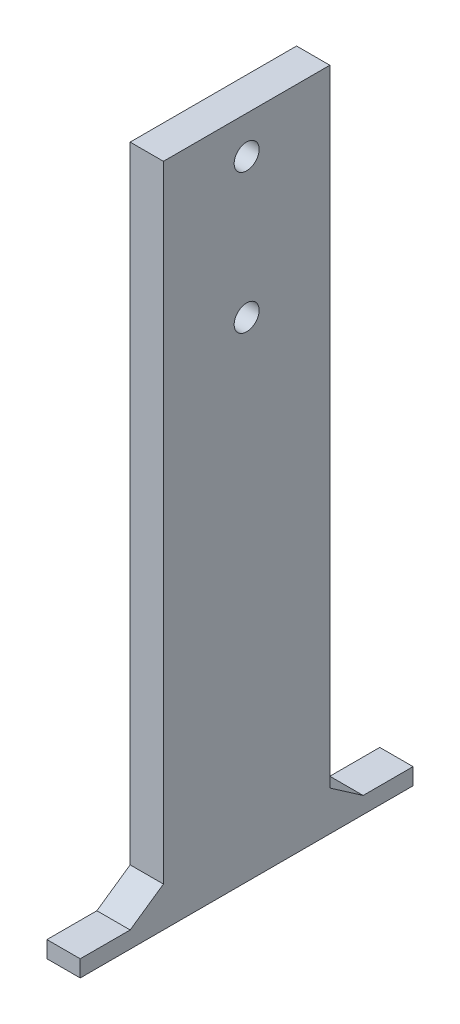
from build123d import *

# Parameters (mm, degrees)
BOSS_EXTRUDE1_DEPTH = 200
SKETCH2_R           = 3.75
CUT_EXTRUDE1_DEPTH  = 10
CUT_EXTRUDE2_DEPTH  = 10


with BuildPart() as part:
    # Sketch1 → Boss-Extrude1 (new body)
    with BuildSketch(Plane(origin=(0, 0, 0), x_dir=(1, 0, 0), z_dir=(0, 1, 0))):
        Polygon((10, 0), (10, 50), (10, 75), (0, 75), (0, 50), (0, 0), (0, -25), (10, -25), align=None)
    extrude(amount=BOSS_EXTRUDE1_DEPTH)

    # Sketch2 → Cut-Extrude1 (cut)
    with BuildSketch(Plane(origin=(10, 0, 0), x_dir=(0, 0, -1), z_dir=(1, 0, 0))):
        with Locations((25, 188.775303779)):
            Circle(SKETCH2_R)
        with Locations((25, 146.899681817)):
            Circle(SKETCH2_R)
    extrude(amount=-CUT_EXTRUDE1_DEPTH, mode=Mode.SUBTRACT)

    # Sketch3 → Cut-Extrude2 (cut)
    with BuildSketch(Plane.ZY):
        Polygon((25, 200), (25, 5), (10, 5), (0, 11.937821542), (0, 200), align=None)
        Polygon((-75, 5), (-60, 5), (-50, 11.937821542), (-50, 200), (-75, 200), align=None)
    extrude(amount=-CUT_EXTRUDE2_DEPTH, mode=Mode.SUBTRACT)


solid = part.part
